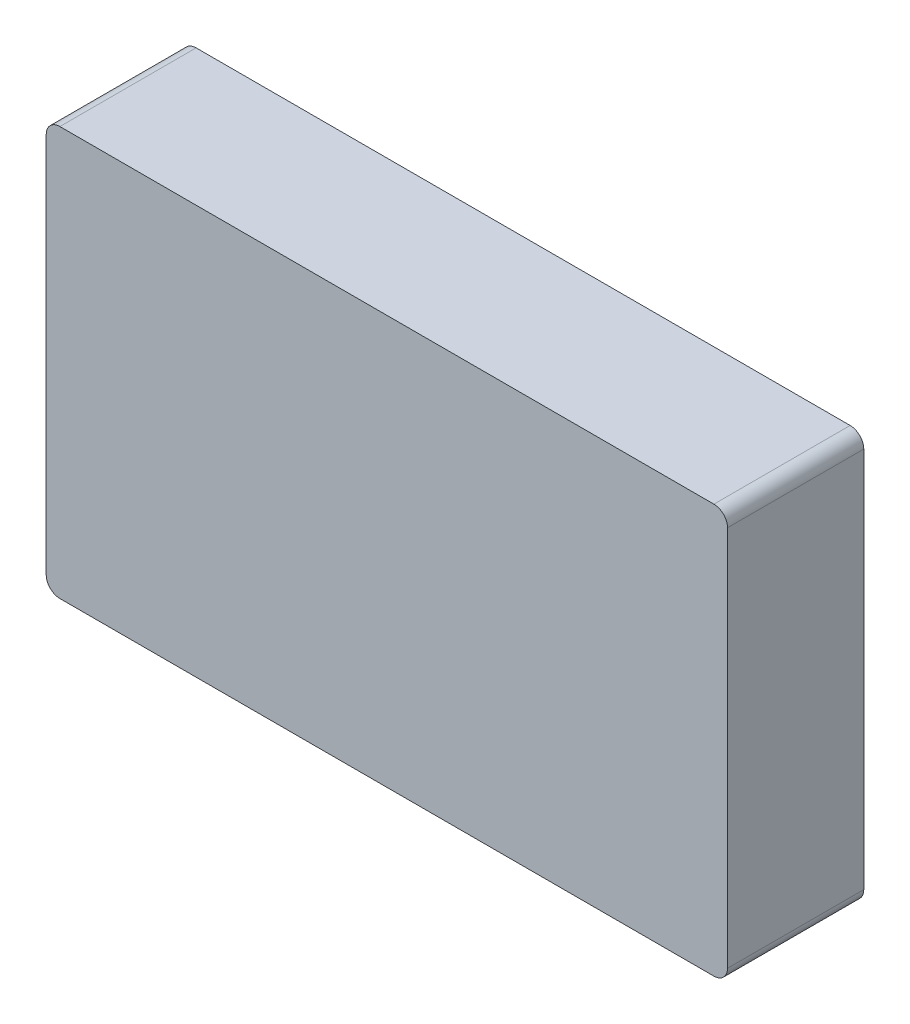
from build123d import *

# Parameters (mm, degrees)
ESQUISSE1_W        = 25
ESQUISSE1_H        = 15
BOSS_EXTRU_1_DEPTH = 5
CONG_1_R           = 0.5


with BuildPart() as part:
    # Esquisse1 → Boss.-Extru.1 (new body)
    with BuildSketch(Plane.XY):
        with Locations((12.5, 7.5)):
            Rectangle(ESQUISSE1_W, ESQUISSE1_H)
    extrude(amount=BOSS_EXTRU_1_DEPTH)

    # Congé1
    cong_1_edges = [part.edges().sort_by_distance(p)[0] for p in [
        (0, 0, 2.5),
        (0, 15, 2.5),
        (25, 15, 2.5),
        (25, 0, 2.5),
    ]]
    fillet(cong_1_edges, radius=CONG_1_R)


solid = part.part
